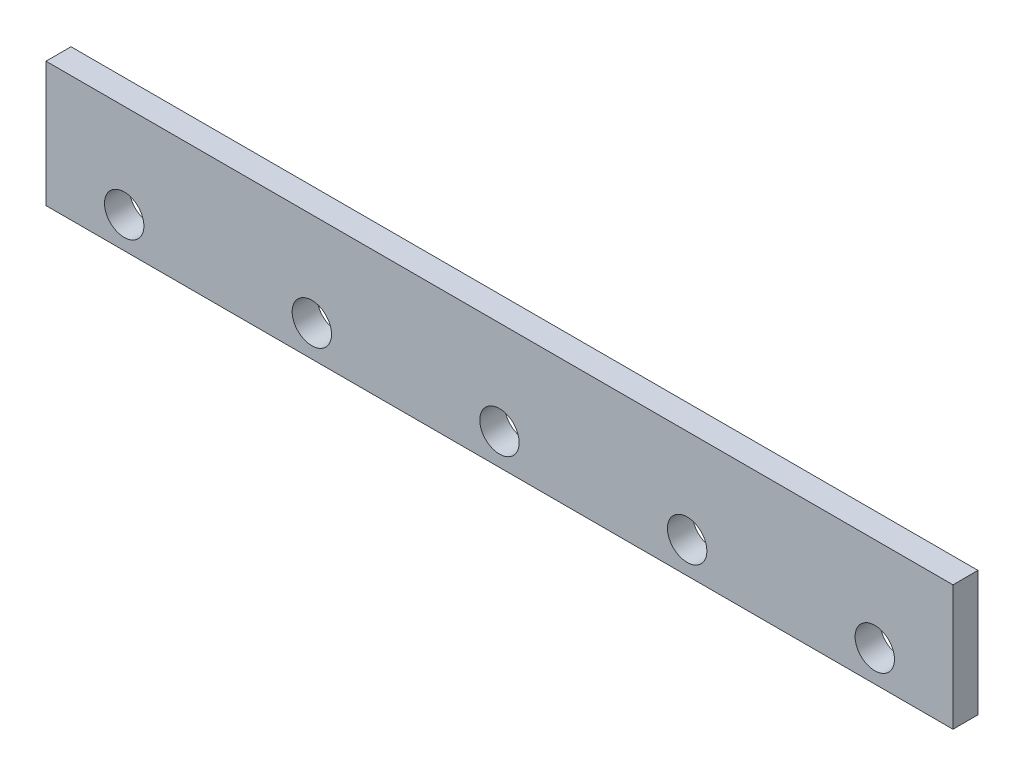
from build123d import *

# Parameters (mm, degrees)
SKETCH_1_W      = 580
SKETCH_1_H      = 80
SKETCH_1_R      = 12.6
EXTRUDE_1_DEPTH = 16


with BuildPart() as part:
    # 草圖1 → 填料-伸長1 (new body)
    with BuildSketch(Plane.XY):
        with Locations((290, 40)):
            Rectangle(SKETCH_1_W, SKETCH_1_H)
        with Locations((50, 20)):
            Circle(SKETCH_1_R, mode=Mode.SUBTRACT)
        with Locations((170, 20)):
            Circle(SKETCH_1_R, mode=Mode.SUBTRACT)
        with Locations((290, 20)):
            Circle(SKETCH_1_R, mode=Mode.SUBTRACT)
        with Locations((410, 20)):
            Circle(SKETCH_1_R, mode=Mode.SUBTRACT)
        with Locations((530, 20)):
            Circle(SKETCH_1_R, mode=Mode.SUBTRACT)
    extrude(amount=EXTRUDE_1_DEPTH)


solid = part.part
